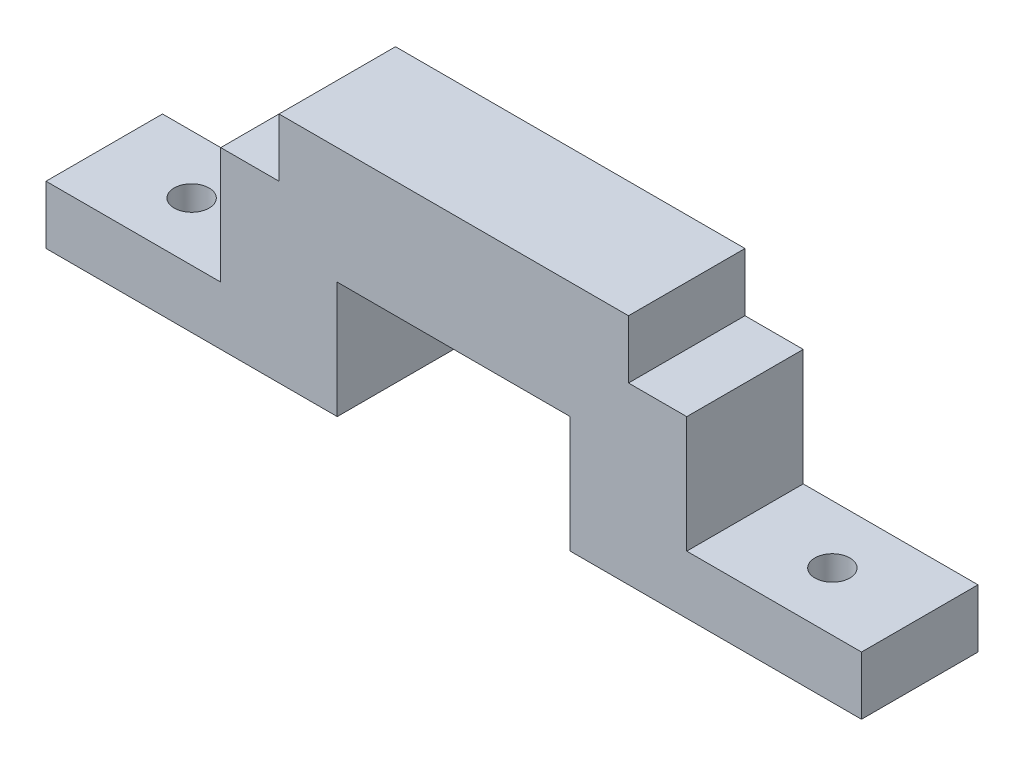
from build123d import *

# Parameters (mm, degrees)
EXTRUDE_1_DEPTH          = 10
CUT_EXTRUDE_1_DEPTH      = 40.37003937
CUT_EXTRUDE_1_DEPTH_BACK = 40.37003937
SKETCH_2_R               = 1.5


with BuildPart() as part:
    # 草图1 → 凸台-拉伸1 (new body)
    with BuildSketch(Plane.XY):
        Polygon((-20, 0), (-10, 0), (-10, 10), (10, 10), (10, 0), (20, 0), (35, 0), (35, 5), (20, 5), (20, 15), (15, 15), (15, 20), (-15, 20), (-15, 15), (-20, 15), (-20, 5), (-35, 5), (-35, 0), align=None)
    extrude(amount=EXTRUDE_1_DEPTH)

    # 草图2 → 切除-拉伸1 (cut, two sides: drawn at the far end of the back side and taken through both)
    with BuildSketch(Plane(origin=(0, 5, 0), x_dir=(1, 0, 0), z_dir=(0, 1, 0)).offset(-CUT_EXTRUDE_1_DEPTH_BACK)):
        with Locations(Location((-27.5, -5, 0), (0, 0, 180))):
            Circle(SKETCH_2_R)
        with Locations(Location((27.5, -5, 0), (0, 0, 180))):
            Circle(SKETCH_2_R)
    extrude(amount=CUT_EXTRUDE_1_DEPTH + CUT_EXTRUDE_1_DEPTH_BACK, mode=Mode.SUBTRACT)


solid = part.part
